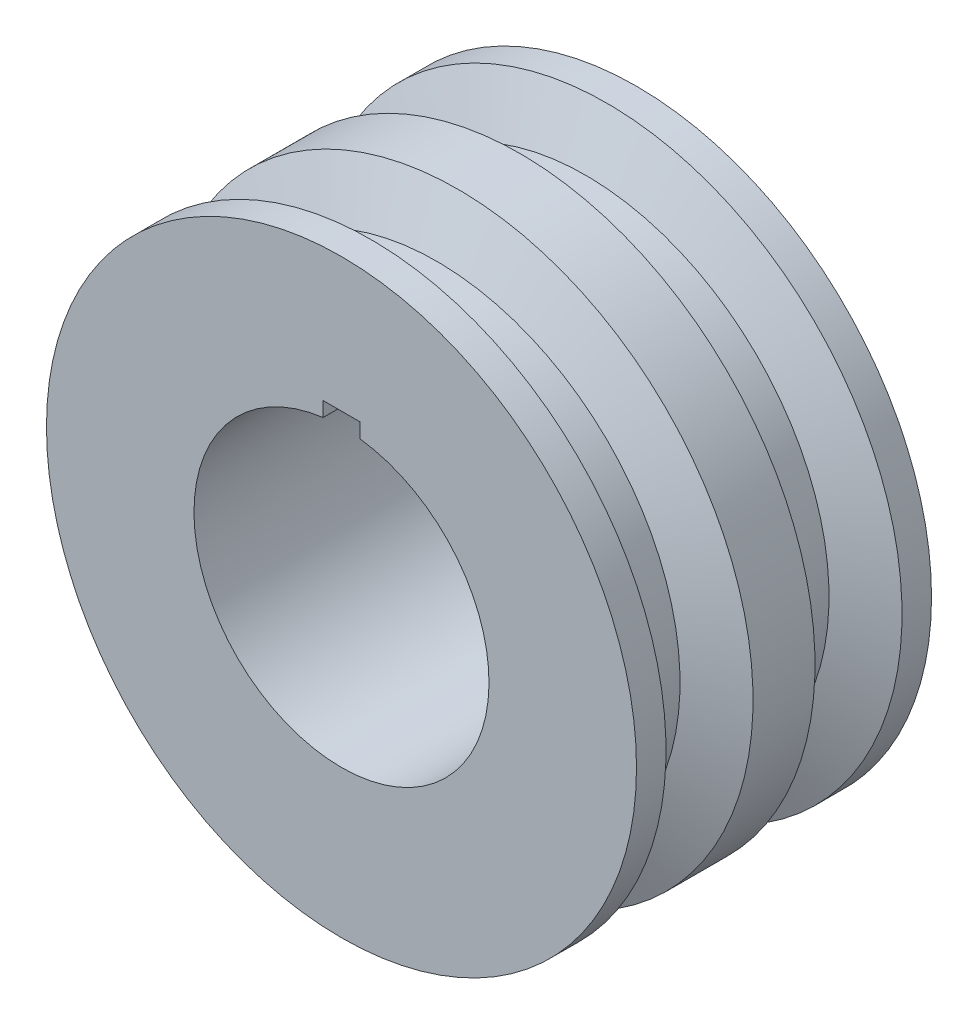
from build123d import *

# Parameters (mm, degrees)
SZKIC1_R                    = 40
DODANIE_WYCI_GNI_CIE1_DEPTH = 40


with BuildPart() as part:
    # Szkic1 → Dodanie-wyciągnięcie1 (new body)
    with BuildSketch(Plane.XY):
        Circle(SZKIC1_R)
        with BuildLine():
            Line((-2.5, 19.843134833), (-2.5, 21.843134833))
            Line((-2.5, 21.843134833), (2.5, 21.843134833))
            Line((2.5, 21.843134833), (2.5, 19.843134833))
            ThreePointArc((2.5, 19.843134833), (0, -20), (-2.5, 19.843134833))
        make_face(mode=Mode.SUBTRACT)
    extrude(amount=DODANIE_WYCI_GNI_CIE1_DEPTH)

    # Szkic3 → Wycięcie-obrót1 (revolve, cut)
    with BuildSketch(Plane(origin=(0, 0, 0), x_dir=(1, 0, 0), z_dir=(0, 1, 0)), mode=Mode.PRIVATE) as wyci_cie_obr_t1_sk:
        Polygon((40, -4), (33, -6.899494937), (33, -12.899494937), (40, -15.798989873), align=None)
        Polygon((40, -36), (40, -24.201010127), (33, -27.100505063), (33, -33.100505063), align=None)
    revolve(wyci_cie_obr_t1_sk.sketch.rotate(Axis((0, 0, 0), (0, 0, 1)), 180), axis=Axis((0, 0, 0), (0, 0, 1)), mode=Mode.SUBTRACT)


solid = part.part
